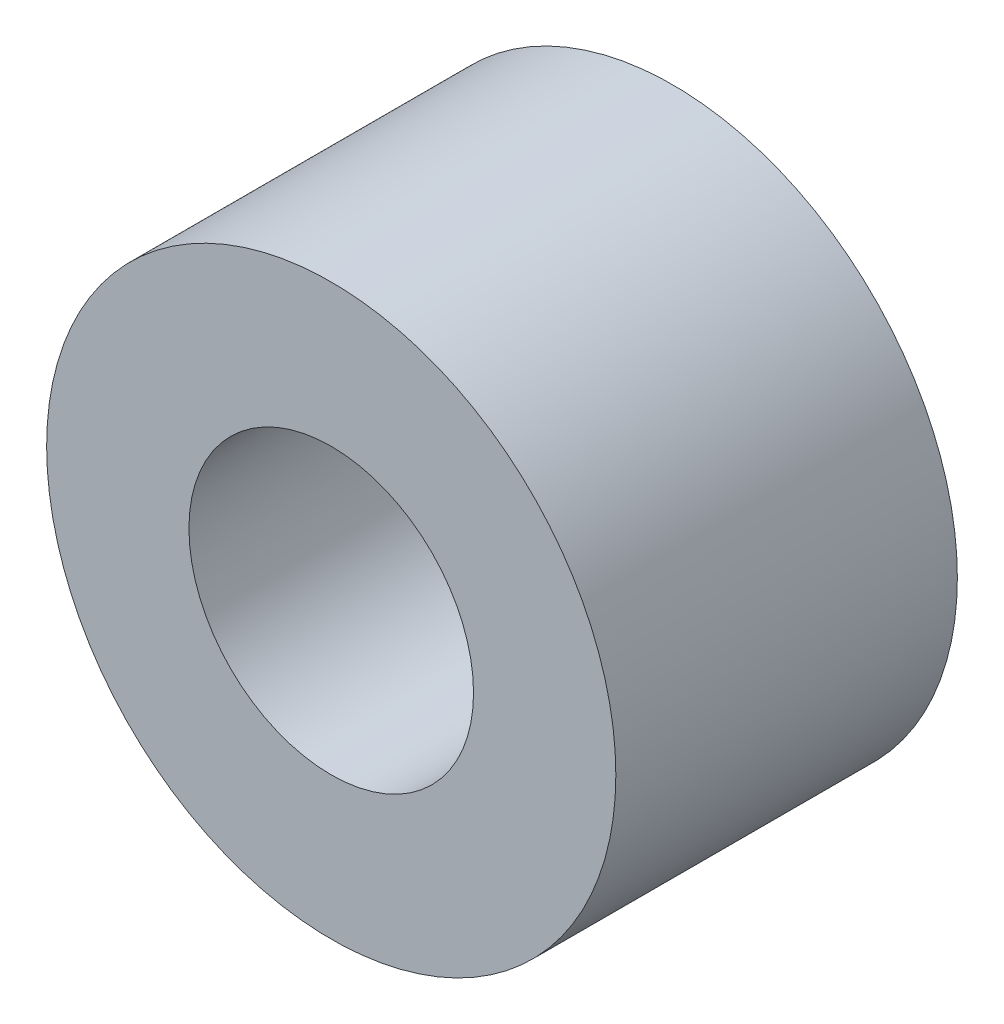
from build123d import *

# Parameters (mm, degrees)
SKETCH_1_R      = 5
SKETCH_1_R_2    = 2.5
EXTRUDE_1_DEPTH = 6


with BuildPart() as part:
    # 草图1 → 凸台-拉伸1 (new body)
    with BuildSketch(Plane.XY):
        with Locations((-19.85, -19.85)):
            Circle(SKETCH_1_R)
        with Locations((-19.85, -19.85)):
            Circle(SKETCH_1_R_2, mode=Mode.SUBTRACT)
    extrude(amount=EXTRUDE_1_DEPTH)


solid = part.part
